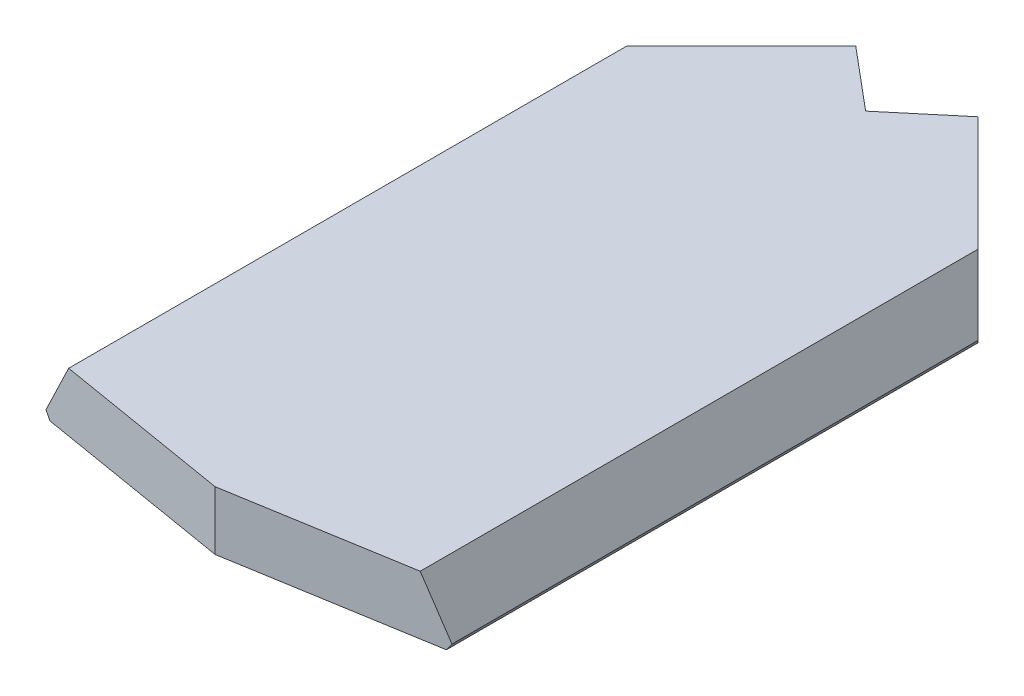
from build123d import *

# Parameters (mm, degrees)
BOSS_EXTRUDE1_START = -39.622072
BOSS_EXTRUDE1_DEPTH = 95.622072
SKETCH3_OUTSIDE_W   = 79.464
SKETCH3_OUTSIDE_H   = 119.774
CUT_EXTRUDE1_DEPTH  = 63.967259819


with BuildPart() as part:
    # Sketch2 → Boss-Extrude1 (new body)
    with BuildSketch(Plane.XY.offset(BOSS_EXTRUDE1_START)):
        Polygon((23.948813845, 0), (27.656388216, -7.053975388), (27.005057694, -8), (-27.005057694, -8), (-27.656388216, -7.053975388), (-23.948813845, 0), align=None)
    extrude(amount=BOSS_EXTRUDE1_DEPTH)

    # Sketch3 outside → Cut-Extrude1 (cut, through all)
    with BuildSketch(Plane(origin=(0, 0, 0), x_dir=(1, 0, 0), z_dir=(0, 1, 0))):
        with Locations((0, -8.189)):
            Rectangle(SKETCH3_OUTSIDE_W, SKETCH3_OUTSIDE_H)
        Polygon((0, 32.635105346), (8.326742195, 39.622071651), (27.656388216, 20.292425629), (27.656388216, -51.380750229), (0, -56), (-27.656388216, -51.380750229), (-27.656388216, 20.292425629), (-8.326742195, 39.622071651), align=None, mode=Mode.SUBTRACT)
    extrude(amount=-CUT_EXTRUDE1_DEPTH, mode=Mode.SUBTRACT)


solid = part.part
